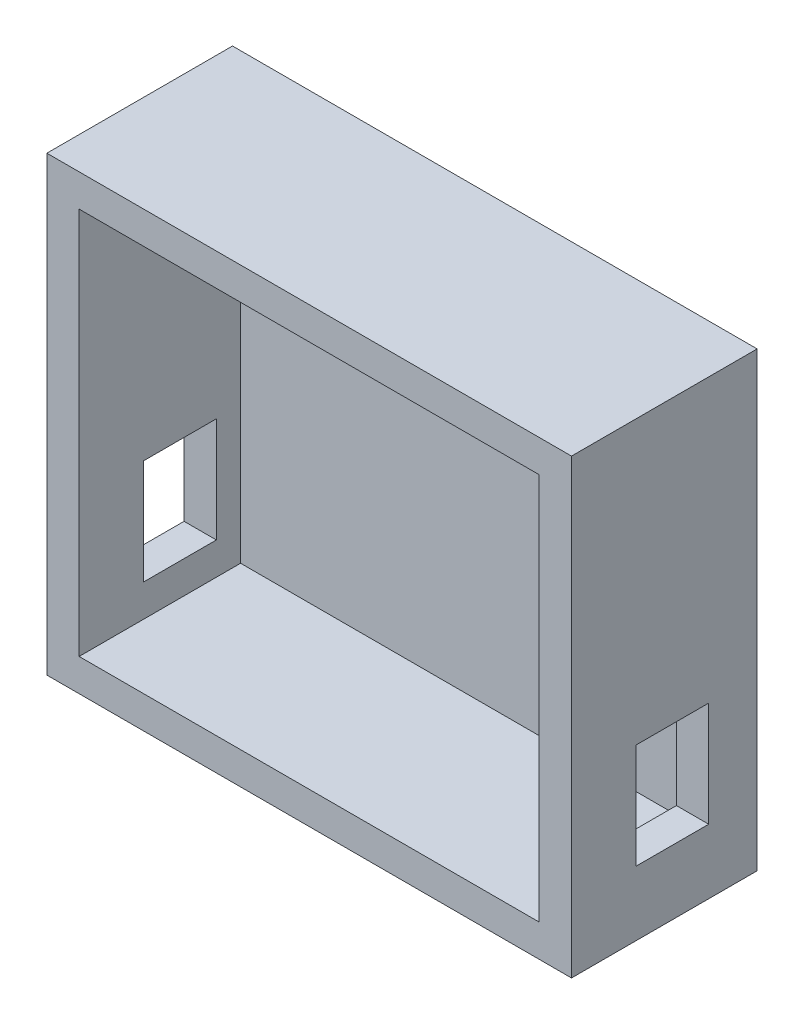
from build123d import *

# Parameters (mm, degrees)
SKETCH1_W           = 65
SKETCH1_H           = 56
BOSS_EXTRUDE1_DEPTH = 23
SKETCH2_W           = 57
SKETCH2_H           = 48
CUT_EXTRUDE1_DEPTH  = 20
SKETCH5_W           = 9
SKETCH5_H           = 13
CUT_EXTRUDE2_DEPTH  = 75.417739821


with BuildPart() as part:
    # Sketch1 → Boss-Extrude1 (new body)
    with BuildSketch(Plane.XY):
        Rectangle(SKETCH1_W, SKETCH1_H)
    extrude(amount=BOSS_EXTRUDE1_DEPTH)

    # Sketch2 → Cut-Extrude1 (cut)
    with BuildSketch(Plane.XY.offset(23)):
        Rectangle(SKETCH2_W, SKETCH2_H)
    extrude(amount=-CUT_EXTRUDE1_DEPTH, mode=Mode.SUBTRACT)

    # Sketch5 → Cut-Extrude2 (cut, through all)
    with BuildSketch(Plane.ZY.offset(32.5)):
        with Locations((10.5, -13.5)):
            Rectangle(SKETCH5_W, SKETCH5_H)
    extrude(amount=-CUT_EXTRUDE2_DEPTH, mode=Mode.SUBTRACT)


solid = part.part
